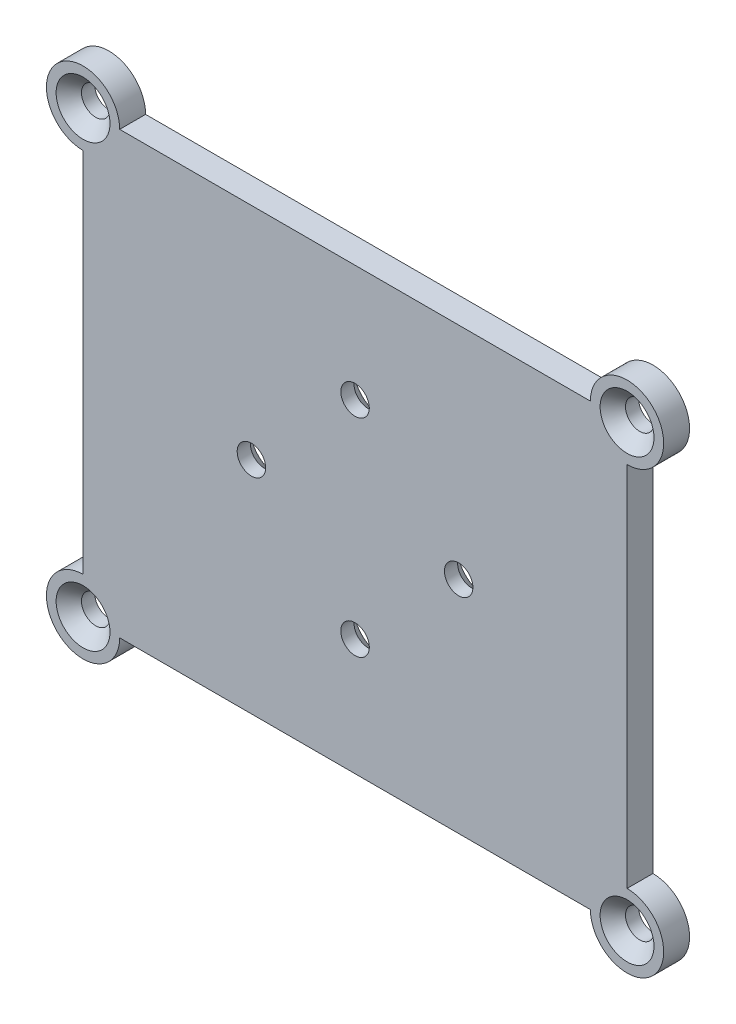
from build123d import *

# Parameters (mm, degrees)
SKETCH1_W                                      = 75
SKETCH1_H                                      = 95
SKETCH1_R                                      = 1
BOSS_EXTRUDE1_DEPTH                            = 5
CSK_FOR_M5_FLAT_HEAD_MACHINE_SCREW1_AT_2_COUNT = 2
CSK_FOR_M5_FLAT_HEAD_MACHINE_SCREW1_AT_2_PITCH = 28.284271247
CSK_FOR_M5_FLAT_HEAD_MACHINE_SCREW1_AT_3_COUNT = 2
CSK_FOR_M5_FLAT_HEAD_MACHINE_SCREW1_AT_3_PITCH = 40
CSK_FOR_M5_FLAT_HEAD_MACHINE_SCREW1_AT_4_COUNT = 2
CSK_FOR_M5_FLAT_HEAD_MACHINE_SCREW1_AT_4_PITCH = 28.284271247
BOSS_EXTRUDE2_DEPTH                            = 5
CSK_FOR_M5_FLAT_HEAD_MACHINE_SCREW2_AT_2_COUNT = 2
CSK_FOR_M5_FLAT_HEAD_MACHINE_SCREW2_AT_2_PITCH = 105
CSK_FOR_M5_FLAT_HEAD_MACHINE_SCREW2_AT_3_COUNT = 2
CSK_FOR_M5_FLAT_HEAD_MACHINE_SCREW2_AT_3_PITCH = 135.092560861
CSK_FOR_M5_FLAT_HEAD_MACHINE_SCREW2_AT_4_COUNT = 2
CSK_FOR_M5_FLAT_HEAD_MACHINE_SCREW2_AT_4_PITCH = 85


with BuildPart() as part:
    # Sketch1 → Boss-Extrude1 (new body)
    with BuildSketch(Plane(origin=(0, 0, 0), x_dir=(0, 1, 0), z_dir=(0, 0, 1))):
        Rectangle(SKETCH1_W, SKETCH1_H)
        with Locations(Location((0, 20, 0), (0, 0, 270))):
            Circle(SKETCH1_R, mode=Mode.SUBTRACT)
        with Locations(Location((20, 0, 0), (0, 0, 270))):
            Circle(SKETCH1_R, mode=Mode.SUBTRACT)
        with Locations(Location((0, -20, 0), (0, 0, 270))):
            Circle(SKETCH1_R, mode=Mode.SUBTRACT)
        with Locations(Location((-20, 0, 0), (0, 0, 270))):
            Circle(SKETCH1_R, mode=Mode.SUBTRACT)
    extrude(amount=BOSS_EXTRUDE1_DEPTH)

    # Sketch2 → CSK for M5 Flat Head Machine Screw1 (revolve, cut)
    with BuildSketch(Plane(origin=(0, 20, 0), x_dir=(0, 1, 0), z_dir=(1, 0, 0))):
        Polygon((0, 0), (0, 5), (2.75, 5), (2.75, 2.45), (5.2, 0), align=None)
    csk_for_m5_flat_head_machine_screw1 = revolve(axis=Axis((0, 20, -6.35), (0, 0, 1)), mode=Mode.SUBTRACT)

    # CSK for M5 Flat Head Machine Screw1 at 2: CSK for M5 Flat Head Machine Screw1 ×2
    with Locations(*[Vector(-0.7071067811865475, -0.7071067811865477, 0) * (i * CSK_FOR_M5_FLAT_HEAD_MACHINE_SCREW1_AT_2_PITCH) for i in range(1, CSK_FOR_M5_FLAT_HEAD_MACHINE_SCREW1_AT_2_COUNT)]):
        add(csk_for_m5_flat_head_machine_screw1, mode=Mode.SUBTRACT)

    # CSK for M5 Flat Head Machine Screw1 at 3: CSK for M5 Flat Head Machine Screw1 ×2
    with Locations(*[(0, -i * CSK_FOR_M5_FLAT_HEAD_MACHINE_SCREW1_AT_3_PITCH, 0) for i in range(1, CSK_FOR_M5_FLAT_HEAD_MACHINE_SCREW1_AT_3_COUNT)]):
        add(csk_for_m5_flat_head_machine_screw1, mode=Mode.SUBTRACT)

    # CSK for M5 Flat Head Machine Screw1 at 4: CSK for M5 Flat Head Machine Screw1 ×2
    with Locations(*[Vector(0.7071067811865478, -0.7071067811865472, 0) * (i * CSK_FOR_M5_FLAT_HEAD_MACHINE_SCREW1_AT_4_PITCH) for i in range(1, CSK_FOR_M5_FLAT_HEAD_MACHINE_SCREW1_AT_4_COUNT)]):
        add(csk_for_m5_flat_head_machine_screw1, mode=Mode.SUBTRACT)

    # Sketch3 → Boss-Extrude2 (add)
    with BuildSketch(Plane.XY.offset(5)):
        with BuildLine():
            ThreePointArc((-45.428932188, 42.5), (-57.5, 47.5), (-52.5, 35.428932188))
            Line((-52.5, 35.428932188), (-52.5, 42.5))
            Line((-52.5, 42.5), (-45.428932188, 42.5))
        make_face()
        with BuildLine():
            Line((-52.5, 42.5), (-52.5, 35.428932188))
            ThreePointArc((-52.5, 35.428932188), (-49.794019499, 35.967185176), (-47.5, 37.5))
            ThreePointArc((-47.5, 37.5), (-45.967185176, 39.794019499), (-45.428932188, 42.5))
            Line((-45.428932188, 42.5), (-52.5, 42.5))
        make_face()
        with BuildLine():
            ThreePointArc((-45.428932188, 42.5), (-45.967185176, 39.794019499), (-47.5, 37.5))
            Line((-47.5, 37.5), (47.5, 37.5))
            ThreePointArc((47.5, 37.5), (45.967185176, 39.794019499), (45.428932188, 42.5))
            Line((45.428932188, 42.5), (-45.428932188, 42.5))
        make_face()
        with BuildLine():
            ThreePointArc((45.428932188, 42.5), (45.967185176, 39.794019499), (47.5, 37.5))
            ThreePointArc((47.5, 37.5), (49.794019499, 35.967185176), (52.5, 35.428932188))
            Line((52.5, 35.428932188), (52.5, 42.5))
            Line((52.5, 42.5), (45.428932188, 42.5))
        make_face()
        with BuildLine():
            ThreePointArc((59.571067812, 42.5), (52.5, 49.571067812), (45.428932188, 42.5))
            Line((45.428932188, 42.5), (52.5, 42.5))
            Line((52.5, 42.5), (52.5, 35.428932188))
            ThreePointArc((52.5, 35.428932188), (57.5, 37.5), (59.571067812, 42.5))
        make_face()
        with BuildLine():
            Line((47.5, 37.5), (47.5, -37.5))
            ThreePointArc((47.5, -37.5), (49.794019499, -35.967185176), (52.5, -35.428932188))
            Line((52.5, -35.428932188), (52.5, 35.428932188))
            ThreePointArc((52.5, 35.428932188), (49.794019499, 35.967185176), (47.5, 37.5))
        make_face()
        with BuildLine():
            ThreePointArc((47.5, -37.5), (45.967185176, -39.794019499), (45.428932188, -42.5))
            Line((45.428932188, -42.5), (52.5, -42.5))
            Line((52.5, -42.5), (52.5, -35.428932188))
            ThreePointArc((52.5, -35.428932188), (49.794019499, -35.967185176), (47.5, -37.5))
        make_face()
        with BuildLine():
            Line((52.5, -42.5), (45.428932188, -42.5))
            ThreePointArc((45.428932188, -42.5), (52.5, -49.571067812), (59.571067812, -42.5))
            ThreePointArc((59.571067812, -42.5), (57.5, -37.5), (52.5, -35.428932188))
            Line((52.5, -35.428932188), (52.5, -42.5))
        make_face()
        with BuildLine():
            ThreePointArc((-47.5, -37.5), (-45.967185176, -39.794019499), (-45.428932188, -42.5))
            Line((-45.428932188, -42.5), (45.428932188, -42.5))
            ThreePointArc((45.428932188, -42.5), (45.967185176, -39.794019499), (47.5, -37.5))
            Line((47.5, -37.5), (-47.5, -37.5))
        make_face()
        with BuildLine():
            Line((-52.5, -35.428932188), (-52.5, -42.5))
            Line((-52.5, -42.5), (-45.428932188, -42.5))
            ThreePointArc((-45.428932188, -42.5), (-45.967185176, -39.794019499), (-47.5, -37.5))
            ThreePointArc((-47.5, -37.5), (-49.794019499, -35.967185176), (-52.5, -35.428932188))
        make_face()
        with BuildLine():
            Line((-45.428932188, -42.5), (-52.5, -42.5))
            Line((-52.5, -42.5), (-52.5, -35.428932188))
            ThreePointArc((-52.5, -35.428932188), (-57.5, -47.5), (-45.428932188, -42.5))
        make_face()
        with BuildLine():
            Line((-52.5, 35.428932188), (-52.5, -35.428932188))
            ThreePointArc((-52.5, -35.428932188), (-49.794019499, -35.967185176), (-47.5, -37.5))
            Line((-47.5, -37.5), (-47.5, 37.5))
            ThreePointArc((-47.5, 37.5), (-49.794019499, 35.967185176), (-52.5, 35.428932188))
        make_face()
    extrude(amount=-BOSS_EXTRUDE2_DEPTH)

    # Sketch5 → CSK for M5 Flat Head Machine Screw2 (revolve, cut)
    with BuildSketch(Plane(origin=(-52.5, 42.5, 5), x_dir=(0, -1, 0), z_dir=(1, 0, 0))):
        Polygon((0, 0), (0, 5), (2.75, 5), (2.75, 2.45), (5.2, 0), align=None)
    csk_for_m5_flat_head_machine_screw2 = revolve(axis=Axis((-52.5, 42.5, 11.35), (0, 0, -1)), mode=Mode.SUBTRACT)

    # CSK for M5 Flat Head Machine Screw2 at 2: CSK for M5 Flat Head Machine Screw2 ×2
    with Locations(*[(i * CSK_FOR_M5_FLAT_HEAD_MACHINE_SCREW2_AT_2_PITCH, 0, 0) for i in range(1, CSK_FOR_M5_FLAT_HEAD_MACHINE_SCREW2_AT_2_COUNT)]):
        add(csk_for_m5_flat_head_machine_screw2, mode=Mode.SUBTRACT)

    # CSK for M5 Flat Head Machine Screw2 at 3: CSK for M5 Flat Head Machine Screw2 ×2
    with Locations(*[Vector(0.7772448707074855, -0.6291982286679645, 0) * (i * CSK_FOR_M5_FLAT_HEAD_MACHINE_SCREW2_AT_3_PITCH) for i in range(1, CSK_FOR_M5_FLAT_HEAD_MACHINE_SCREW2_AT_3_COUNT)]):
        add(csk_for_m5_flat_head_machine_screw2, mode=Mode.SUBTRACT)

    # CSK for M5 Flat Head Machine Screw2 at 4: CSK for M5 Flat Head Machine Screw2 ×2
    with Locations(*[(0, -i * CSK_FOR_M5_FLAT_HEAD_MACHINE_SCREW2_AT_4_PITCH, 0) for i in range(1, CSK_FOR_M5_FLAT_HEAD_MACHINE_SCREW2_AT_4_COUNT)]):
        add(csk_for_m5_flat_head_machine_screw2, mode=Mode.SUBTRACT)


solid = part.part
